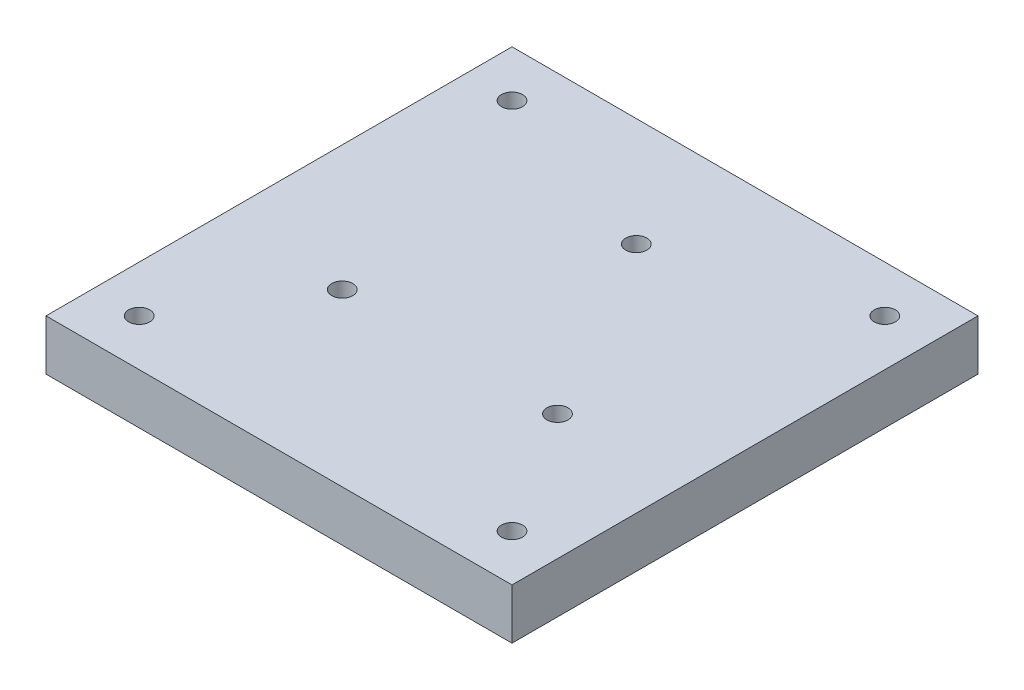
from build123d import *

# Parameters (mm, degrees)
SKETCH3_W                           = 101.6
SKETCH3_H                           = 11.1125
BOSS_EXTRUDE1_DEPTH                 = 50.8
BASEBORDERRADIUSSKETCH_OUTSIDE_W    = 132.41
BASEBORDERRADIUSSKETCH_OUTSIDE_H    = 132.41
BASEBORDERRADIUSSKETCH_OUTSIDE_W_2  = 95.25
BASEBORDERRADIUSSKETCH_OUTSIDE_H_2  = 95.25
BASEBORDERRADIUSCUT_EXTRUDE_DEPTH   = 73.57931249
BUMPER_6_32_TAPPED_HOLE_D           = 4.3053
BUMPER_6_32_TAPPED_HOLE_CBORE_D     = 7.9375
BUMPER_6_32_TAPPED_HOLE_CBORE_DEPTH = 5.3848
BUMPERTHREADLPATTERN_COUNT          = 2
BUMPERTHREADLPATTERN_PITCH          = 76.2
BUMPERTHREADLPATTERN_COUNT_DIR2     = 2
BUMPERTHREADLPATTERN_PITCH_DIR2     = 76.2


with BuildPart() as part:
    # Sketch3 → Boss-Extrude1 (new, symmetric)
    with BuildSketch(Plane.XY):
        Rectangle(SKETCH3_W, SKETCH3_H)
    extrude(amount=BOSS_EXTRUDE1_DEPTH, both=True)

    # FacingTopSurfaceCut
    split(bisect_by=Plane(origin=(0, 5.159375, 0), x_dir=(1, 0, 0), z_dir=(0, 1, 0)), keep=Keep.BOTTOM)

    # FacingBottomSurfaceCut
    split(bisect_by=Plane(origin=(0, -5.159375, 0), x_dir=(-1, 0, 0), z_dir=(0, -1, 0)), keep=Keep.BOTTOM)

    # BaseBorderRadiusSketch outside → BaseBorderRadiusCut-Extrude (cut, through all)
    with BuildSketch(Plane(origin=(0, 5.159375, 0), x_dir=(1, 0, 0), z_dir=(0, 1, 0))):
        Rectangle(BASEBORDERRADIUSSKETCH_OUTSIDE_W, BASEBORDERRADIUSSKETCH_OUTSIDE_H)
        Rectangle(BASEBORDERRADIUSSKETCH_OUTSIDE_W_2, BASEBORDERRADIUSSKETCH_OUTSIDE_H_2, mode=Mode.SUBTRACT)
    extrude(amount=-BASEBORDERRADIUSCUT_EXTRUDE_DEPTH, mode=Mode.SUBTRACT)

    # Bumper#6-32 Tapped Hole (through all)
    with Locations(Plane(origin=(-38.1, -5.159375, 38.1), x_dir=(0, 0, -1), z_dir=(0, -1, 0))):
        with Locations((0, 0), (25.4, 16.102954744), (25.4, 60.097045256), (63.5, 38.1)):
            bumper_6_32_tapped_hole = CounterBoreHole(BUMPER_6_32_TAPPED_HOLE_D / 2, BUMPER_6_32_TAPPED_HOLE_CBORE_D / 2, BUMPER_6_32_TAPPED_HOLE_CBORE_DEPTH)

    # BumperThreadLPattern: Bumper_6-32 Tapped Hole 2 × 2
    with Locations(*[(j * BUMPERTHREADLPATTERN_PITCH_DIR2, 0, -i * BUMPERTHREADLPATTERN_PITCH) for i in range(BUMPERTHREADLPATTERN_COUNT) for j in range(BUMPERTHREADLPATTERN_COUNT_DIR2) if (i, j) != (0, 0)]):
        add(bumper_6_32_tapped_hole, mode=Mode.SUBTRACT)


solid = part.part
